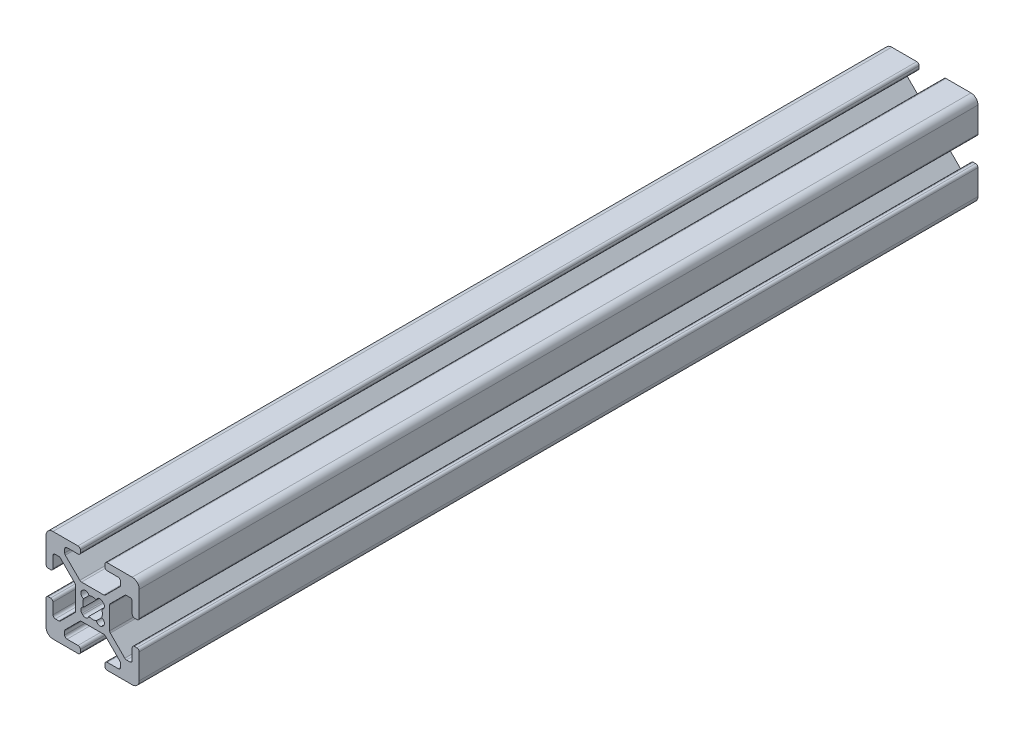
from build123d import *

# Parameters (mm, degrees)
EXTRUDE1_DEPTH     = 180
SKETCH2_R          = 2.5
CUT_EXTRUDE1_DEPTH = 181.793968442


with BuildPart() as part:
    # Sketch1 → Extrude1 (new body)
    with BuildSketch(Plane.XY):
        with BuildLine():
            Line((9.492, 2.63), (9.008, 2.63))
            ThreePointArc((9.008, 2.63), (8.648789755, 2.778789755), (8.5, 3.138))
            Line((8.5, 3.138), (8.5, 5.487))
            ThreePointArc((8.5, 5.487), (8.351210245, 5.846210245), (7.992, 5.995))
            Line((7.992, 5.995), (7.266080661, 5.995))
            ThreePointArc((7.266080661, 5.995), (7.071677478, 5.956330803), (6.906870417, 5.846210245))
            Line((6.906870417, 5.846210245), (3.803789755, 2.743129583))
            ThreePointArc((3.803789755, 2.743129583), (3.693669197, 2.578322522), (3.655, 2.383919339))
            Line((3.655, 2.383919339), (3.655, -2.383919339))
            ThreePointArc((3.655, -2.383919339), (3.693669197, -2.578322522), (3.803789755, -2.743129583))
            Line((3.803789755, -2.743129583), (6.906870417, -5.846210245))
            ThreePointArc((6.906870417, -5.846210245), (7.071677478, -5.956330803), (7.266080661, -5.995))
            Line((7.266080661, -5.995), (7.992, -5.995))
            ThreePointArc((7.992, -5.995), (8.351210245, -5.846210245), (8.5, -5.487))
            Line((8.5, -5.487), (8.5, -3.138))
            ThreePointArc((8.5, -3.138), (8.648789755, -2.778789755), (9.008, -2.63))
            Line((9.008, -2.63), (9.492, -2.63))
            ThreePointArc((9.492, -2.63), (9.851210245, -2.778789755), (10, -3.138))
            Line((10, -3.138), (10, -8.5))
            ThreePointArc((10, -8.5), (9.560660172, -9.560660172), (8.5, -10))
            Line((8.5, -10), (3.138, -10))
            ThreePointArc((3.138, -10), (2.778789755, -9.851210245), (2.63, -9.492))
            Line((2.63, -9.492), (2.63, -9.008))
            ThreePointArc((2.63, -9.008), (2.778789755, -8.648789755), (3.138, -8.5))
            Line((3.138, -8.5), (5.487, -8.5))
            ThreePointArc((5.487, -8.5), (5.846210245, -8.351210245), (5.995, -7.992))
            Line((5.995, -7.992), (5.995, -7.266080661))
            ThreePointArc((5.995, -7.266080661), (5.956330803, -7.071677478), (5.846210245, -6.906870417))
            Line((5.846210245, -6.906870417), (2.743129583, -3.803789755))
            ThreePointArc((2.743129583, -3.803789755), (2.578322522, -3.693669197), (2.383919339, -3.655))
            Line((2.383919339, -3.655), (-2.383919339, -3.655))
            ThreePointArc((-2.383919339, -3.655), (-2.578322522, -3.693669197), (-2.743129583, -3.803789755))
            Line((-2.743129583, -3.803789755), (-5.846210245, -6.906870417))
            ThreePointArc((-5.846210245, -6.906870417), (-5.956330803, -7.071677478), (-5.995, -7.266080661))
            Line((-5.995, -7.266080661), (-5.995, -7.992))
            ThreePointArc((-5.995, -7.992), (-5.846210245, -8.351210245), (-5.487, -8.5))
            Line((-5.487, -8.5), (-3.138, -8.5))
            ThreePointArc((-3.138, -8.5), (-2.778789755, -8.648789755), (-2.63, -9.008))
            Line((-2.63, -9.008), (-2.63, -9.492))
            ThreePointArc((-2.63, -9.492), (-2.778789755, -9.851210245), (-3.138, -10))
            Line((-3.138, -10), (-8.5, -10))
            ThreePointArc((-8.5, -10), (-9.560660172, -9.560660172), (-10, -8.5))
            Line((-10, -8.5), (-10, -3.138))
            ThreePointArc((-10, -3.138), (-9.851210245, -2.778789755), (-9.492, -2.63))
            Line((-9.492, -2.63), (-9.008, -2.63))
            ThreePointArc((-9.008, -2.63), (-8.648789755, -2.778789755), (-8.5, -3.138))
            Line((-8.5, -3.138), (-8.5, -5.487))
            ThreePointArc((-8.5, -5.487), (-8.351210245, -5.846210245), (-7.992, -5.995))
            Line((-7.992, -5.995), (-7.266080661, -5.995))
            ThreePointArc((-7.266080661, -5.995), (-7.071677478, -5.956330803), (-6.906870417, -5.846210245))
            Line((-6.906870417, -5.846210245), (-3.803789755, -2.743129583))
            ThreePointArc((-3.803789755, -2.743129583), (-3.693669197, -2.578322522), (-3.655, -2.383919339))
            Line((-3.655, -2.383919339), (-3.655, 2.383919339))
            ThreePointArc((-3.655, 2.383919339), (-3.693669197, 2.578322522), (-3.803789755, 2.743129583))
            Line((-3.803789755, 2.743129583), (-6.906870417, 5.846210245))
            ThreePointArc((-6.906870417, 5.846210245), (-7.071677478, 5.956330803), (-7.266080661, 5.995))
            Line((-7.266080661, 5.995), (-7.992, 5.995))
            ThreePointArc((-7.992, 5.995), (-8.351210245, 5.846210245), (-8.5, 5.487))
            Line((-8.5, 5.487), (-8.5, 3.138))
            ThreePointArc((-8.5, 3.138), (-8.648789755, 2.778789755), (-9.008, 2.63))
            Line((-9.008, 2.63), (-9.492, 2.63))
            ThreePointArc((-9.492, 2.63), (-9.851210245, 2.778789755), (-10, 3.138))
            Line((-10, 3.138), (-10, 8.5))
            ThreePointArc((-10, 8.5), (-9.560660172, 9.560660172), (-8.5, 10))
            Line((-8.5, 10), (-3.138, 10))
            ThreePointArc((-3.138, 10), (-2.778789755, 9.851210245), (-2.63, 9.492))
            Line((-2.63, 9.492), (-2.63, 9.008))
            ThreePointArc((-2.63, 9.008), (-2.778789755, 8.648789755), (-3.138, 8.5))
            Line((-3.138, 8.5), (-5.487, 8.5))
            ThreePointArc((-5.487, 8.5), (-5.846210245, 8.351210245), (-5.995, 7.992))
            Line((-5.995, 7.992), (-5.995, 7.266080661))
            ThreePointArc((-5.995, 7.266080661), (-5.956330803, 7.071677478), (-5.846210245, 6.906870417))
            Line((-5.846210245, 6.906870417), (-2.743129583, 3.803789755))
            ThreePointArc((-2.743129583, 3.803789755), (-2.578322522, 3.693669197), (-2.383919339, 3.655))
            Line((-2.383919339, 3.655), (2.383919339, 3.655))
            ThreePointArc((2.383919339, 3.655), (2.578322522, 3.693669197), (2.743129583, 3.803789755))
            Line((2.743129583, 3.803789755), (5.846210245, 6.906870417))
            ThreePointArc((5.846210245, 6.906870417), (5.956330803, 7.071677478), (5.995, 7.266080661))
            Line((5.995, 7.266080661), (5.995, 7.992))
            ThreePointArc((5.995, 7.992), (5.846210245, 8.351210245), (5.487, 8.5))
            Line((5.487, 8.5), (3.138, 8.5))
            ThreePointArc((3.138, 8.5), (2.778789755, 8.648789755), (2.63, 9.008))
            Line((2.63, 9.008), (2.63, 9.492))
            ThreePointArc((2.63, 9.492), (2.778789755, 9.851210245), (3.138, 10))
            Line((3.138, 10), (8.5, 10))
            ThreePointArc((8.5, 10), (9.560660172, 9.560660172), (10, 8.5))
            Line((10, 8.5), (10, 3.138))
            ThreePointArc((10, 3.138), (9.851210245, 2.778789755), (9.492, 2.63))
        make_face()
        with BuildLine():
            Line((2.124900844, -2.304505966), (2.304505966, -2.124900844))
            ThreePointArc((2.304505966, -2.124900844), (2.505938017, -1.356467811), (1.935133506, -0.803976718))
            ThreePointArc((1.935133506, -0.803976718), (2.0955, 0), (1.935133506, 0.803976718))
            ThreePointArc((1.935133506, 0.803976718), (2.505938017, 1.356467811), (2.304505966, 2.124900844))
            Line((2.304505966, 2.124900844), (2.124900844, 2.304505966))
            ThreePointArc((2.124900844, 2.304505966), (1.356467811, 2.505938017), (0.803976718, 1.935133506))
            ThreePointArc((0.803976718, 1.935133506), (0, 2.0955), (-0.803976718, 1.935133506))
            ThreePointArc((-0.803976718, 1.935133506), (-1.356467811, 2.505938017), (-2.124900844, 2.304505966))
            Line((-2.124900844, 2.304505966), (-2.304505966, 2.124900844))
            ThreePointArc((-2.304505966, 2.124900844), (-2.505938017, 1.356467811), (-1.935133506, 0.803976718))
            ThreePointArc((-1.935133506, 0.803976718), (-2.0955, 0), (-1.935133506, -0.803976718))
            ThreePointArc((-1.935133506, -0.803976718), (-2.505938017, -1.356467811), (-2.304505966, -2.124900844))
            Line((-2.304505966, -2.124900844), (-2.124900844, -2.304505966))
            ThreePointArc((-2.124900844, -2.304505966), (-1.356467811, -2.505938017), (-0.803976718, -1.935133506))
            ThreePointArc((-0.803976718, -1.935133506), (0, -2.0955), (0.803976718, -1.935133506))
            ThreePointArc((0.803976718, -1.935133506), (1.356467811, -2.505938017), (2.124900844, -2.304505966))
        make_face(mode=Mode.SUBTRACT)
    extrude(amount=-EXTRUDE1_DEPTH)

    # Sketch2 → Cut-Extrude1 (cut, through all)
    with BuildSketch(Plane(origin=(0, 3.655, 0), x_dir=(1, 0, 0), z_dir=(0, 1, 0))):
        with Locations(Location((0, 170, 0), (0, 0, 288.759150212))):
            Circle(SKETCH2_R)
        with Locations(Location((0, 10, 0), (0, 0, 288.759150212))):
            Circle(SKETCH2_R)
    extrude(amount=-CUT_EXTRUDE1_DEPTH, mode=Mode.SUBTRACT)


solid = part.part
